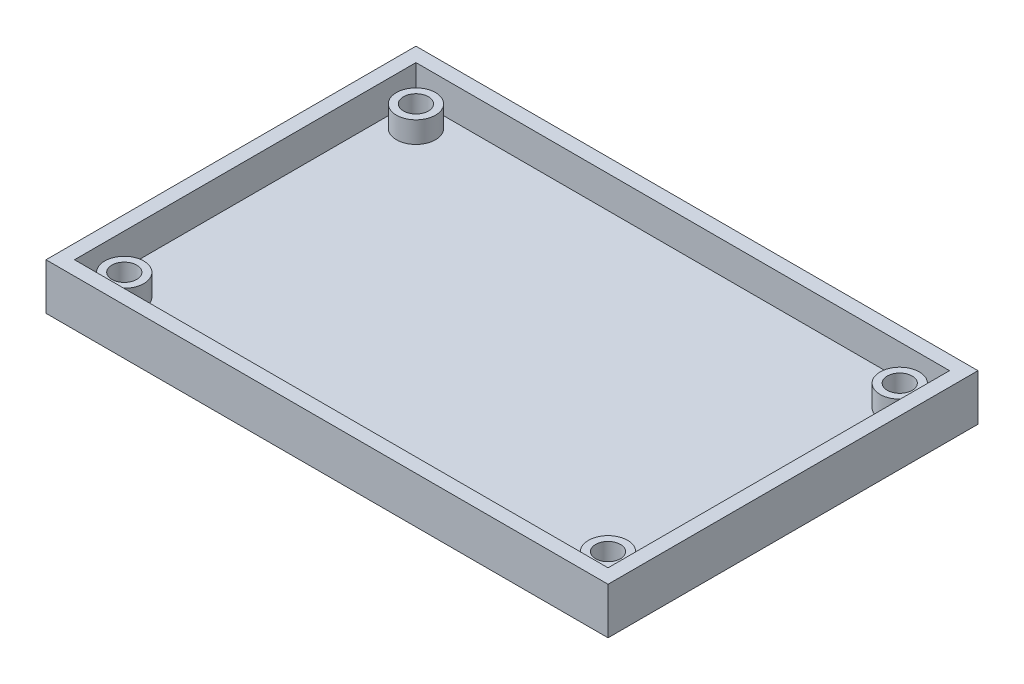
from build123d import *

# Parameters (mm, degrees)
SKETCH1_W           = 79
SKETCH1_H           = 52
SKETCH1_W_2         = 75
SKETCH1_H_2         = 48
BOSS_EXTRUDE1_DEPTH = 4.524
SKETCH2_W           = 79
SKETCH2_H           = 52
BOSS_EXTRUDE2_DEPTH = 2
SKETCH3_R           = 1.9
CUT_EXTRUDE1_DEPTH  = 2
SKETCH4_R           = 2.75
SKETCH4_R_2         = 1.75
BOSS_EXTRUDE3_DEPTH = 3


with BuildPart() as part:
    # Sketch1 → Boss-Extrude1 (new body)
    with BuildSketch(Plane(origin=(0, 0, 0), x_dir=(1, 0, 0), z_dir=(0, 1, 0))):
        Rectangle(SKETCH1_W, SKETCH1_H)
        Rectangle(SKETCH1_W_2, SKETCH1_H_2, mode=Mode.SUBTRACT)
    extrude(amount=BOSS_EXTRUDE1_DEPTH)

    # Sketch2 → Boss-Extrude2 (add)
    with BuildSketch(Plane.XZ):
        Rectangle(SKETCH2_W, SKETCH2_H)
    extrude(amount=BOSS_EXTRUDE2_DEPTH)

    # Sketch3 → Cut-Extrude1 (cut)
    with BuildSketch(Plane(origin=(0, 0, 0), x_dir=(1, 0, 0), z_dir=(0, 1, 0))):
        with Locations(Location((-34, 20.5, 0), (0, 0, 270))):
            Circle(SKETCH3_R)
        with Locations(Location((34, 20.5, 0), (0, 0, 270))):
            Circle(SKETCH3_R)
        with Locations(Location((34, -20.5, 0), (0, 0, 270))):
            Circle(SKETCH3_R)
        with Locations(Location((-34, -20.5, 0), (0, 0, 270))):
            Circle(SKETCH3_R)
    extrude(amount=-CUT_EXTRUDE1_DEPTH, mode=Mode.SUBTRACT)

    # Sketch4 → Boss-Extrude3 (add)
    # profile 1 of 4: a face of its own
    with BuildSketch(Plane(origin=(0, 0, 0), x_dir=(1, 0, 0), z_dir=(0, 1, 0))):
        with Locations(Location((-34, -20.5, 0), (0, 0, 270))):
            Circle(SKETCH4_R)
        with Locations(Location((-34, -20.5, 0), (0, 0, 270))):
            Circle(SKETCH4_R_2, mode=Mode.SUBTRACT)
    # profile 2 of 4: a face of its own
    with BuildSketch(Plane(origin=(0, 0, 0), x_dir=(1, 0, 0), z_dir=(0, 1, 0))):
        with Locations(Location((34, -20.5, 0), (0, 0, 270))):
            Circle(SKETCH4_R)
        with Locations(Location((34, -20.5, 0), (0, 0, 270))):
            Circle(SKETCH4_R_2, mode=Mode.SUBTRACT)
    # profile 3 of 4: a face of its own
    with BuildSketch(Plane(origin=(0, 0, 0), x_dir=(1, 0, 0), z_dir=(0, 1, 0))):
        with Locations(Location((34, 20.5, 0), (0, 0, 270))):
            Circle(SKETCH4_R)
        with Locations(Location((34, 20.5, 0), (0, 0, 270))):
            Circle(SKETCH4_R_2, mode=Mode.SUBTRACT)
    # profile 4 of 4: a face of its own
    with BuildSketch(Plane(origin=(0, 0, 0), x_dir=(1, 0, 0), z_dir=(0, 1, 0))):
        with Locations(Location((-34, 20.5, 0), (0, 0, 270))):
            Circle(SKETCH4_R)
        with Locations(Location((-34, 20.5, 0), (0, 0, 270))):
            Circle(SKETCH4_R_2, mode=Mode.SUBTRACT)
    extrude(amount=BOSS_EXTRUDE3_DEPTH)


solid = part.part
